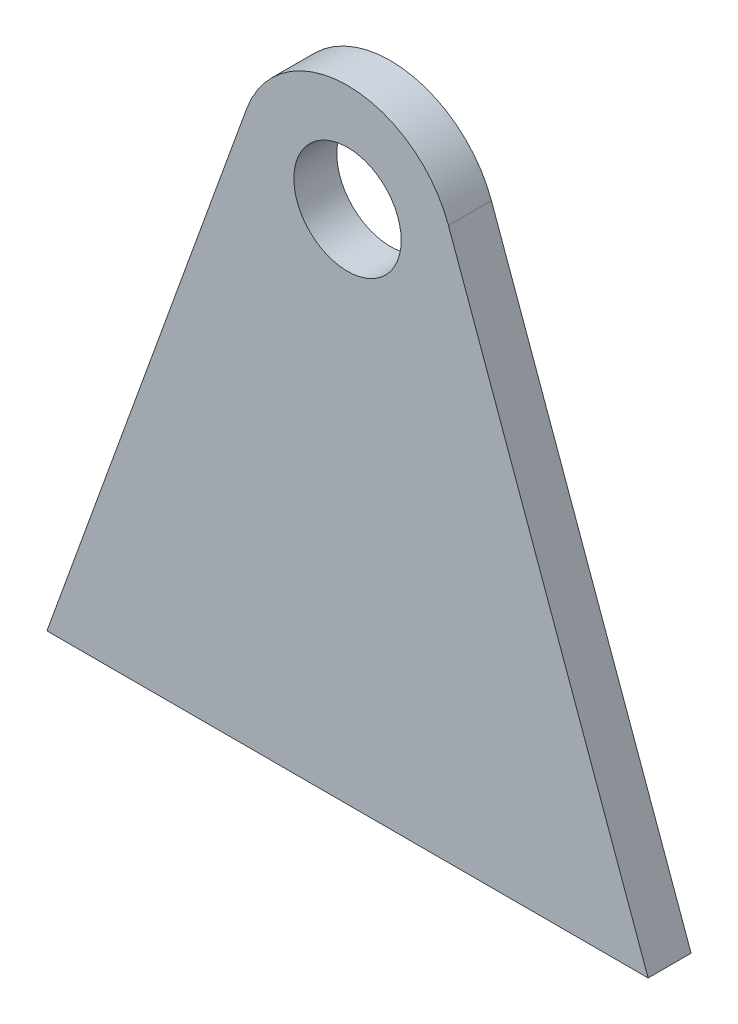
from build123d import *

# Parameters (mm, degrees)
EXTRUDE_1_DEPTH = 20
F_20_0MM_1_D    = 50


with BuildPart() as part:
    # 草圖1 → 填料-伸長1 (new body)
    with BuildSketch(Plane.XY):
        with BuildLine():
            Line((0, 0), (140, 0))
            Line((140, 0), (47.017565913, 257.010246783))
            ThreePointArc((47.017565913, 257.010246783), (28.718353547, 280.929893349), (0, 290))
            Line((0, 290), (0, 0))
        make_face()
    extrude_1 = extrude(amount=EXTRUDE_1_DEPTH)

    # 鏡射1: 填料-伸長1 across plane
    add(extrude_1.mirror(Plane(origin=(0, 290, 20), x_dir=(0, 0, 1), z_dir=(1, 0, 0))))

    # Ø20.0mm 定位孔1 (through all)
    with Locations(Plane.XY.offset(20)):
        with Locations((0, 240)):
            Hole(F_20_0MM_1_D / 2)


solid = part.part
